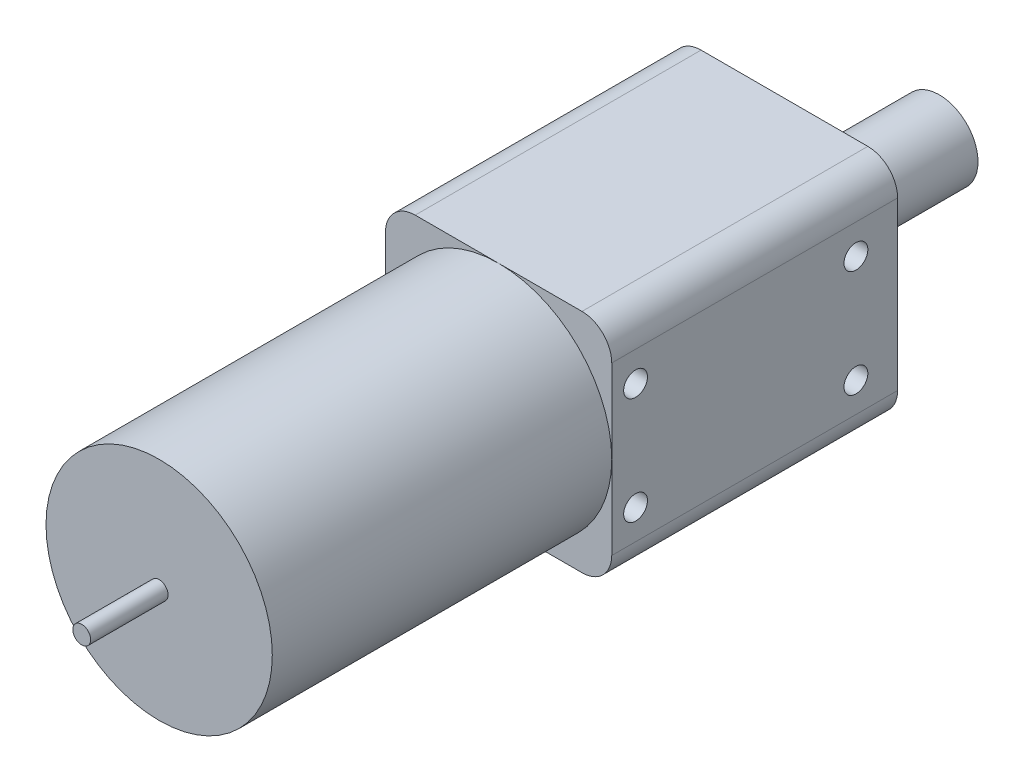
from build123d import *

# Parameters (mm, degrees)
SKETCH1_R           = 19
BOSS_EXTRUDE1_DEPTH = 57
SKETCH3_W           = 38
SKETCH3_H           = 38
BOSS_EXTRUDE3_DEPTH = 48
SKETCH4_R           = 6.5
BOSS_EXTRUDE4_DEPTH = 26
SKETCH5_R           = 1.5
BOSS_EXTRUDE5_DEPTH = 13
FILLET1_R           = 5
SKETCH6_R           = 2
CUT_EXTRUDE1_DEPTH  = 10
CUT_EXTRUDE2_START  = -10
SKETCH7_R           = 2
CUT_EXTRUDE2_DEPTH  = 10


with BuildPart() as part:
    # Sketch1 → Boss-Extrude1 (new body)
    with BuildSketch(Plane.XY):
        with Locations(Location((0, 0, 0), (0, 0, 180))):
            Circle(SKETCH1_R)
    extrude(amount=BOSS_EXTRUDE1_DEPTH)

    # Sketch3 → Boss-Extrude3 (add)
    with BuildSketch(Plane(origin=(0, 0, 0), x_dir=(-1, 0, 0), z_dir=(0, 0, -1))):
        Rectangle(SKETCH3_W, SKETCH3_H)
    extrude(amount=BOSS_EXTRUDE3_DEPTH)

    # Sketch4 → Boss-Extrude4 (add)
    with BuildSketch(Plane(origin=(0, 0, -48), x_dir=(-1, 0, 0), z_dir=(0, 0, -1))):
        with Locations(Location((0, 0, 0), (0, 0, 180))):
            Circle(SKETCH4_R)
    extrude(amount=BOSS_EXTRUDE4_DEPTH)

    # Sketch5 → Boss-Extrude5 (add)
    with BuildSketch(Plane.XY.offset(57)):
        with Locations(Location((0, 0, 0), (0, 0, 180))):
            Circle(SKETCH5_R)
    extrude(amount=BOSS_EXTRUDE5_DEPTH)

    # Fillet1
    fillet1_edges = [part.edges().sort_by_distance(p)[0] for p in [
        (-19, -19, -24),
        (-19, 19, -24),
        (19, 19, -24),
        (19, -19, -24),
    ]]
    fillet(fillet1_edges, radius=FILLET1_R)

    # Sketch6 → Cut-Extrude1 (cut)
    with BuildSketch(Plane.ZY.offset(19)):
        with Locations((-4, 9)):
            Circle(SKETCH6_R)
        with Locations((-4, -9)):
            Circle(SKETCH6_R)
        with Locations((-41, -9)):
            Circle(SKETCH6_R)
        with Locations((-41, 9)):
            Circle(SKETCH6_R)
    extrude(amount=-CUT_EXTRUDE1_DEPTH, mode=Mode.SUBTRACT)

    # Sketch7 → Cut-Extrude2 (cut)
    with BuildSketch(Plane(origin=(19, 0, 0), x_dir=(0, 0, -1), z_dir=(1, 0, 0)).offset(CUT_EXTRUDE2_START)):
        with Locations(Location((41, 9, 0), (0, 0, 180))):
            Circle(SKETCH7_R)
        with Locations(Location((41, -9, 0), (0, 0, 180))):
            Circle(SKETCH7_R)
        with Locations(Location((4, -9, 0), (0, 0, 180))):
            Circle(SKETCH7_R)
        with Locations(Location((4, 9, 0), (0, 0, 180))):
            Circle(SKETCH7_R)
    extrude(amount=CUT_EXTRUDE2_DEPTH, mode=Mode.SUBTRACT)


solid = part.part
